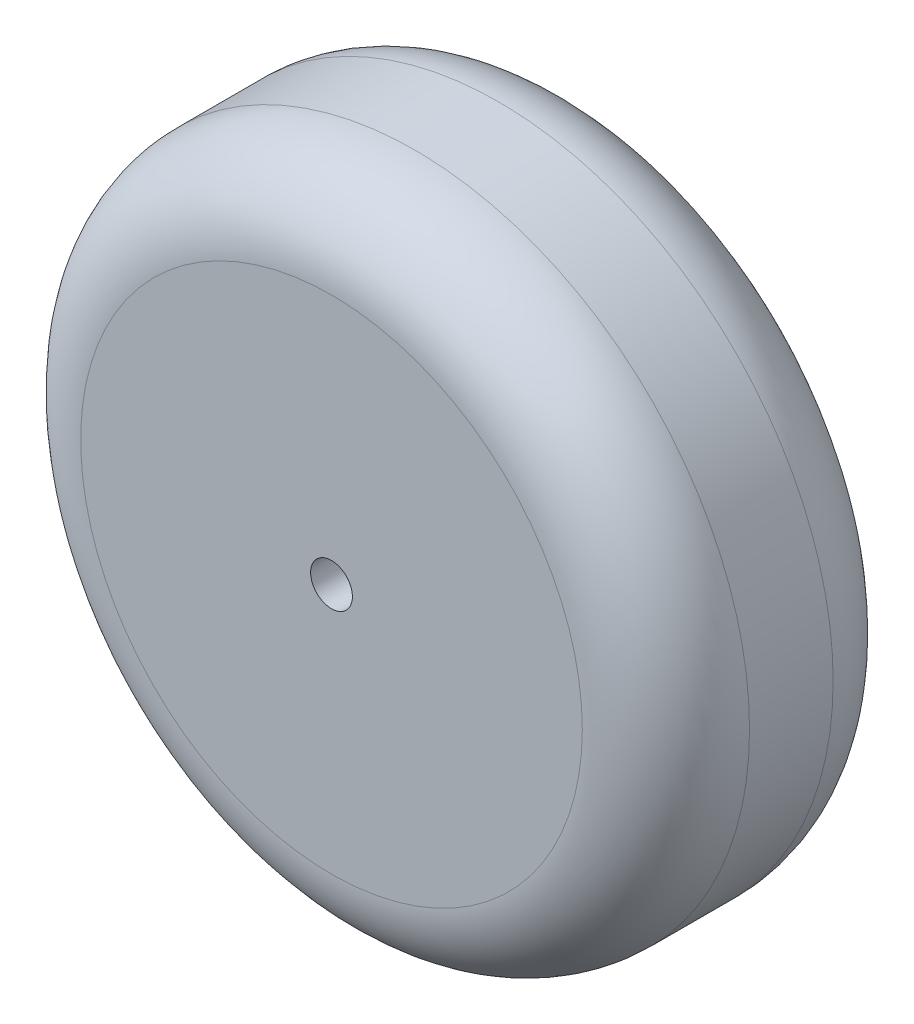
from build123d import *

# Parameters (mm, degrees)
SKETCH1_R           = 40
BOSS_EXTRUDE1_DEPTH = 30
FILLET1_R           = 10
SKETCH2_R           = 2.5
CUT_EXTRUDE1_DEPTH  = 30


with BuildPart() as part:
    # Sketch1 → Boss-Extrude1 (new body)
    with BuildSketch(Plane.XY):
        Circle(SKETCH1_R)
    extrude(amount=BOSS_EXTRUDE1_DEPTH)

    # Fillet1
    fillet1_edges = [part.edges().sort_by_distance(p)[0] for p in [
        (-40, 0, 0),
        (-40, 0, 30),
    ]]
    fillet(fillet1_edges, radius=FILLET1_R)

    # Sketch2 → Cut-Extrude1 (cut)
    with BuildSketch(Plane.XY.offset(30)):
        Circle(SKETCH2_R)
    extrude(amount=-CUT_EXTRUDE1_DEPTH, mode=Mode.SUBTRACT)


solid = part.part
